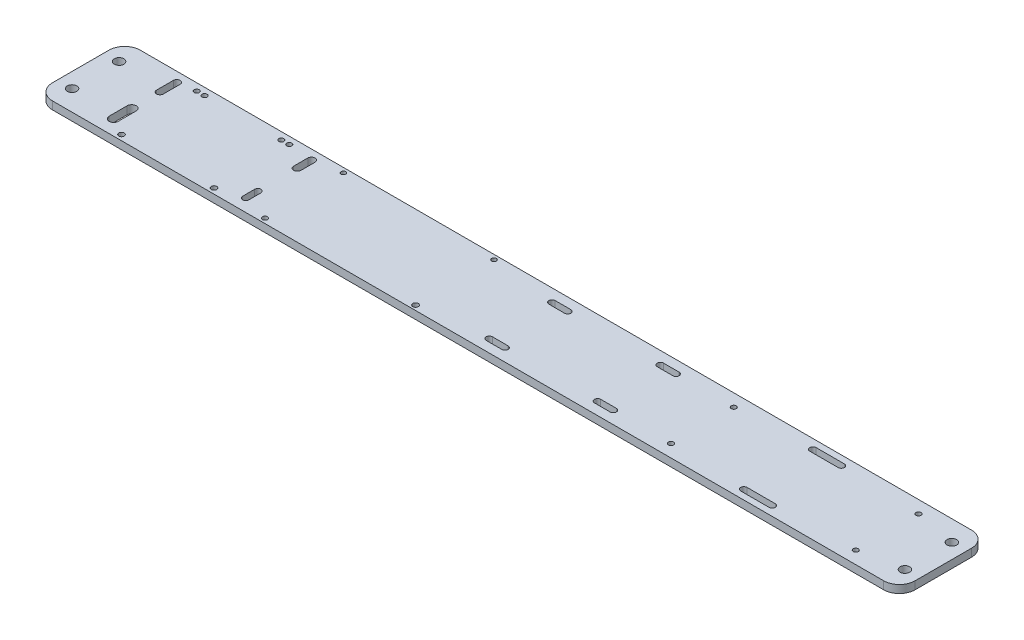
from build123d import *

# Parameters (mm, degrees)
SKETCH_1_W      = 550
SKETCH_1_H      = 56
SKETCH_1_R      = 3.05
SKETCH_1_R_2    = 1.6
SKETCH_1_R_3    = 1.741142055
SKETCH_1_R_4    = 1.469666532
SKETCH_1_R_5    = 1.619836661
SKETCH_1_R_6    = 1.494419625
SKETCH_1_R_7    = 1.78071741
EXTRUDE_1_DEPTH = 5
FILLET_1_R      = 10


with BuildPart() as part:
    # 草图1 → 凸台-拉伸1 (new body)
    with BuildSketch(Plane(origin=(0, 0, 0), x_dir=(1, 0, 0), z_dir=(0, 1, 0))):
        with Locations((0, 28)):
            Rectangle(SKETCH_1_W, SKETCH_1_H)
        with Locations(Location((-265.5, 43, 0), (0, 0, 270))):
            Circle(SKETCH_1_R, mode=Mode.SUBTRACT)
        with Locations(Location((-265.5, 13, 0), (0, 0, 270))):
            Circle(SKETCH_1_R, mode=Mode.SUBTRACT)
        with Locations(Location((265.5, 13, 0), (0, 0, 90))):
            Circle(SKETCH_1_R, mode=Mode.SUBTRACT)
        with Locations(Location((265.5, 43, 0), (0, 0, 90))):
            Circle(SKETCH_1_R, mode=Mode.SUBTRACT)
        with Locations(Location((239.176550925, 48, 0), (0, 0, 270))):
            Circle(SKETCH_1_R_2, mode=Mode.SUBTRACT)
        with Locations(Location((239.176550925, 8, 0), (0, 0, 270))):
            Circle(SKETCH_1_R_2, mode=Mode.SUBTRACT)
        with Locations(Location((121.376550925, 48, 0), (0, 0, 270))):
            Circle(SKETCH_1_R_2, mode=Mode.SUBTRACT)
        with Locations(Location((121.376550925, 8, 0), (0, 0, 270))):
            Circle(SKETCH_1_R_2, mode=Mode.SUBTRACT)
        with Locations(Location((-170.393257171, 51.376890861, 0), (0, 0, 270))):
            Circle(SKETCH_1_R_2, mode=Mode.SUBTRACT)
        with Locations(Location((-219.393257171, 51.376890861, 0), (0, 0, 270))):
            Circle(SKETCH_1_R_2, mode=Mode.SUBTRACT)
        with Locations(Location((-224.393257171, 51.376890861, 0), (0, 0, 270))):
            Circle(SKETCH_1_R_2, mode=Mode.SUBTRACT)
        with Locations(Location((-224.393257171, 3.414613144, 0), (0, 0, 270))):
            Circle(SKETCH_1_R_3, mode=Mode.SUBTRACT)
        with Locations(Location((-165.393257171, 51.376890861, 0), (0, 0, 270))):
            Circle(SKETCH_1_R_2, mode=Mode.SUBTRACT)
        with Locations(Location((-165.393257171, 3.414613144, 0), (0, 0, 270))):
            Circle(SKETCH_1_R_3, mode=Mode.SUBTRACT)
        with Locations(Location((-132.483237063, 53, 0), (0, 0, 270))):
            Circle(SKETCH_1_R_4, mode=Mode.SUBTRACT)
        with Locations(Location((-132.483237063, 3, 0), (0, 0, 270))):
            Circle(SKETCH_1_R_5, mode=Mode.SUBTRACT)
        with Locations(Location((-36.483237063, 53, 0), (0, 0, 270))):
            Circle(SKETCH_1_R_6, mode=Mode.SUBTRACT)
        with Locations(Location((-36.483237063, 3, 0), (0, 0, 270))):
            Circle(SKETCH_1_R_7, mode=Mode.SUBTRACT)
        with BuildLine():
            Line((-147.397504582, 49.857044682), (-147.397504582, 40.853271456))
            ThreePointArc((-147.397504582, 40.853271456), (-149.731816159, 38.518959879), (-152.066127736, 40.853271456))
            Line((-152.066127736, 40.853271456), (-152.066127736, 49.857044682))
            ThreePointArc((-152.066127736, 49.857044682), (-149.731816159, 52.191356259), (-147.397504582, 49.857044682))
        make_face(mode=Mode.SUBTRACT)
        with BuildLine():
            Line((-147.730977664, 15.67605373), (-147.730977664, 8))
            ThreePointArc((-147.730977664, 8), (-149.731816159, 5.999161505), (-151.732654654, 8))
            Line((-151.732654654, 8), (-151.732654654, 15.67605373))
            ThreePointArc((-151.732654654, 15.67605373), (-149.731816159, 17.676892225), (-147.730977664, 15.67605373))
        make_face(mode=Mode.SUBTRACT)
        with BuildLine():
            Line((-233.443564049, 49.857044682), (-233.443564049, 39.145889274))
            ThreePointArc((-233.443564049, 39.145889274), (-235.604469624, 36.984983699), (-237.765375198, 39.145889274))
            Line((-237.765375198, 39.145889274), (-237.765375198, 49.857044682))
            ThreePointArc((-237.765375198, 49.857044682), (-235.604469624, 52.017950257), (-233.443564049, 49.857044682))
        make_face(mode=Mode.SUBTRACT)
        with BuildLine():
            Line((-232.723262191, 21.138342821), (-232.723262191, 9.613513091))
            ThreePointArc((-232.723262191, 9.613513091), (-235.604469624, 6.732305658), (-238.485677056, 9.613513091))
            Line((-238.485677056, 9.613513091), (-238.485677056, 21.138342821))
            ThreePointArc((-238.485677056, 21.138342821), (-235.604469624, 24.019550253), (-232.723262191, 21.138342821))
        make_face(mode=Mode.SUBTRACT)
        with BuildLine():
            Line((15.525688633, 46), (5.525688633, 46))
            ThreePointArc((5.525688633, 46), (3.525688633, 48), (5.525688633, 50))
            Line((5.525688633, 50), (15.525688633, 50))
            ThreePointArc((15.525688633, 50), (17.525688633, 48), (15.525688633, 46))
        make_face(mode=Mode.SUBTRACT)
        with BuildLine():
            Line((84.556283314, 46), (74.556283314, 46))
            ThreePointArc((74.556283314, 46), (72.556283314, 48), (74.556283314, 50))
            Line((74.556283314, 50), (84.556283314, 50))
            ThreePointArc((84.556283314, 50), (86.556283314, 48), (84.556283314, 46))
        make_face(mode=Mode.SUBTRACT)
        with BuildLine():
            Line((15.525688633, 6), (5.525688633, 6))
            ThreePointArc((5.525688633, 6), (3.525688633, 8), (5.525688633, 10))
            Line((5.525688633, 10), (15.525688633, 10))
            ThreePointArc((15.525688633, 10), (17.525688633, 8), (15.525688633, 6))
        make_face(mode=Mode.SUBTRACT)
        with BuildLine():
            Line((84.556283314, 6), (74.556283314, 6))
            ThreePointArc((74.556283314, 6), (72.556283314, 8), (74.556283314, 10))
            Line((74.556283314, 10), (84.556283314, 10))
            ThreePointArc((84.556283314, 10), (86.556283314, 8), (84.556283314, 6))
        make_face(mode=Mode.SUBTRACT)
        with BuildLine():
            Line((169.833189375, 52), (187.927295943, 52))
            ThreePointArc((187.927295943, 52), (189.927295943, 50), (187.927295943, 48))
            Line((187.927295943, 48), (169.833189375, 48))
            ThreePointArc((169.833189375, 48), (167.833189375, 50), (169.833189375, 52))
        make_face(mode=Mode.SUBTRACT)
        with BuildLine():
            Line((169.833189375, 8), (187.927295943, 8))
            ThreePointArc((187.927295943, 8), (189.927295943, 6), (187.927295943, 4))
            Line((187.927295943, 4), (169.833189375, 4))
            ThreePointArc((169.833189375, 4), (167.833189375, 6), (169.833189375, 8))
        make_face(mode=Mode.SUBTRACT)
    extrude(amount=EXTRUDE_1_DEPTH)

    # 圆角1
    fillet_1_edges = [part.edges().sort_by_distance(p)[0] for p in [
        (-275, 2.5, -56),
        (275, 2.5, -56),
        (275, 2.5, 0),
        (-275, 2.5, 0),
    ]]
    fillet(fillet_1_edges, radius=FILLET_1_R)


solid = part.part
